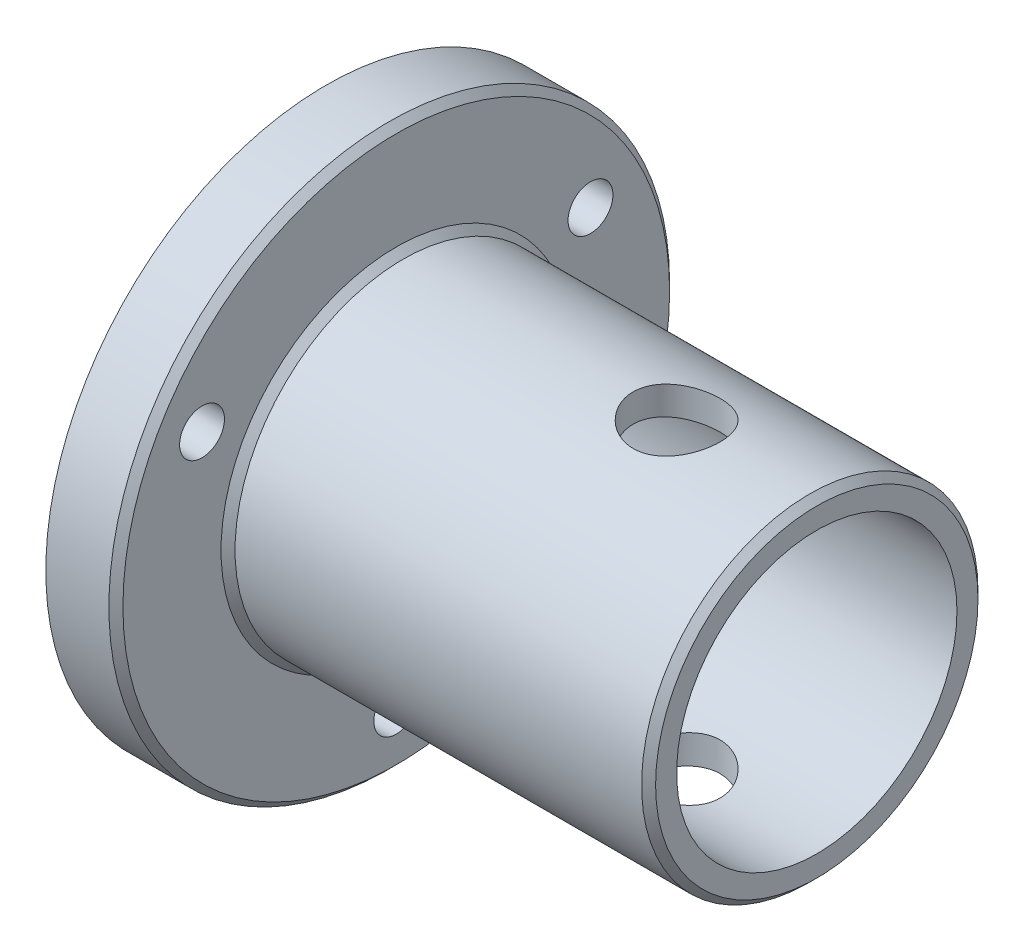
from build123d import *

# Parameters (mm, degrees)
SKETCH_1_R               = 20
EXTRUDE_1_DEPTH          = 5
SKETCH_6_R               = 12
EXTRUDE_2_DEPTH          = 30
SKETCH_7_R               = 10
CUT_EXTRUDE_2_DEPTH      = 30
CHAMFER_1_SIZE           = 0.5
CUT_EXTRUDE_3_DEPTH      = 46
CUT_EXTRUDE_3_DEPTH_BACK = 46
SKETCH_8_R               = 3.1
CHAMFER_2_SIZE           = 0.5
CHAMFER_3_SIZE           = 0.5
SKETCH_9_R               = 1.6
CUT_EXTRUDE_4_DEPTH      = 10


with BuildPart() as part:
    # 草图1 → 凸台-拉伸1 (new body)
    with BuildSketch(Plane(origin=(0, 0, 0), x_dir=(0, 0, -1), z_dir=(1, 0, 0))):
        Circle(SKETCH_1_R)
    extrude(amount=EXTRUDE_1_DEPTH)

    # 草图6 → 凸台-拉伸2 (add)
    with BuildSketch(Plane(origin=(5, 0, 0), x_dir=(0, 0, -1), z_dir=(1, 0, 0))):
        Circle(SKETCH_6_R)
    extrude(amount=EXTRUDE_2_DEPTH)

    # 草图7 → 切除-拉伸2 (cut)
    with BuildSketch(Plane(origin=(35, 0, 0), x_dir=(0, 0, -1), z_dir=(1, 0, 0))):
        Circle(SKETCH_7_R)
    extrude(amount=-CUT_EXTRUDE_2_DEPTH, mode=Mode.SUBTRACT)

    # 倒角1
    chamfer_1_edges = [part.edges().sort_by_distance(p)[0] for p in [
        (35, 0, 12),
    ]]
    chamfer(chamfer_1_edges, length=CHAMFER_1_SIZE)

    # 草图8 → 切除-拉伸3 (cut, two sides: drawn at the far end of the back side and taken through both)
    with BuildSketch(Plane(origin=(0, 0, 0), x_dir=(1, 0, 0), z_dir=(0, 1, 0)).offset(-CUT_EXTRUDE_3_DEPTH_BACK)):
        with Locations(Location((25, 0, 0), (0, 0, 90))):
            Circle(SKETCH_8_R)
    extrude(amount=CUT_EXTRUDE_3_DEPTH + CUT_EXTRUDE_3_DEPTH_BACK, mode=Mode.SUBTRACT)

    # 倒角2
    chamfer_2_edges = [part.edges().sort_by_distance(p)[0] for p in [
        (5, 0, 20),
    ]]
    chamfer(chamfer_2_edges, length=CHAMFER_2_SIZE)

    # 倒角3
    chamfer_3_edges = [part.edges().sort_by_distance(p)[0] for p in [
        (5, 0, 12),
    ]]
    chamfer(chamfer_3_edges, length=CHAMFER_3_SIZE)

    # 草图9 → 切除-拉伸4 (cut)
    with BuildSketch(Plane.ZY):
        with Locations((-13.856406461, 8)):
            Circle(SKETCH_9_R)
        with Locations((13.856406461, 8)):
            Circle(SKETCH_9_R)
        with Locations((0, -16)):
            Circle(SKETCH_9_R)
    extrude(amount=-CUT_EXTRUDE_4_DEPTH, mode=Mode.SUBTRACT)


solid = part.part
